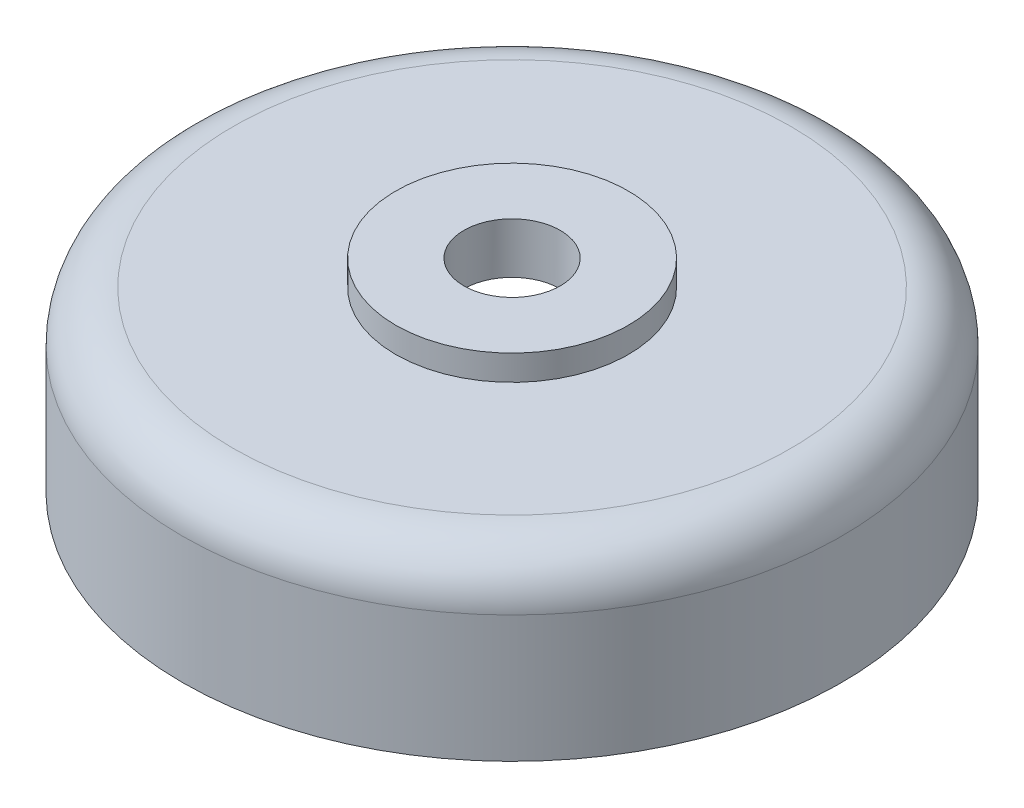
from build123d import *

# Parameters (mm, degrees)
SKETCH1_R           = 65
BOSS_EXTRUDE1_DEPTH = 35
SKETCH2_R           = 22.945
BOSS_EXTRUDE2_DEPTH = 5
SKETCH3_R           = 9.5
CUT_EXTRUDE1_DEPTH  = 99
SKETCH4_R           = 60
CUT_EXTRUDE2_DEPTH  = 30
FILLET1_R           = 10
FILLET2_R           = 10


with BuildPart() as part:
    # Sketch1 → Boss-Extrude1 (new body)
    with BuildSketch(Plane(origin=(0, 0, 0), x_dir=(1, 0, 0), z_dir=(0, 1, 0))):
        with Locations(Location((0, 0, 0), (0, 0, 270))):
            Circle(SKETCH1_R)
    extrude(amount=BOSS_EXTRUDE1_DEPTH)

    # Sketch2 → Boss-Extrude2 (add)
    with BuildSketch(Plane(origin=(0, 35, 0), x_dir=(1, 0, 0), z_dir=(0, 1, 0))):
        with Locations(Location((0, 0, 0), (0, 0, 270))):
            Circle(SKETCH2_R)
    extrude(amount=BOSS_EXTRUDE2_DEPTH)

    # Sketch3 → Cut-Extrude1 (cut)
    with BuildSketch(Plane(origin=(0, 40, 0), x_dir=(1, 0, 0), z_dir=(0, 1, 0))):
        with Locations(Location((0, 0, 0), (0, 0, 270))):
            Circle(SKETCH3_R)
    extrude(amount=-CUT_EXTRUDE1_DEPTH, mode=Mode.SUBTRACT)

    # Sketch4 → Cut-Extrude2 (cut)
    with BuildSketch(Plane.XZ):
        with Locations(Location((0, 0, 0), (0, 0, 270))):
            Circle(SKETCH4_R)
    extrude(amount=-CUT_EXTRUDE2_DEPTH, mode=Mode.SUBTRACT)

    # Fillet1
    fillet1_edges = [part.edges().sort_by_distance(p)[0] for p in [
        (0, 35, -65),
    ]]
    fillet(fillet1_edges, radius=FILLET1_R)

    # Fillet2
    fillet2_edges = [part.edges().sort_by_distance(p)[0] for p in [
        (0, 30, 60),
    ]]
    fillet(fillet2_edges, radius=FILLET2_R)


solid = part.part
